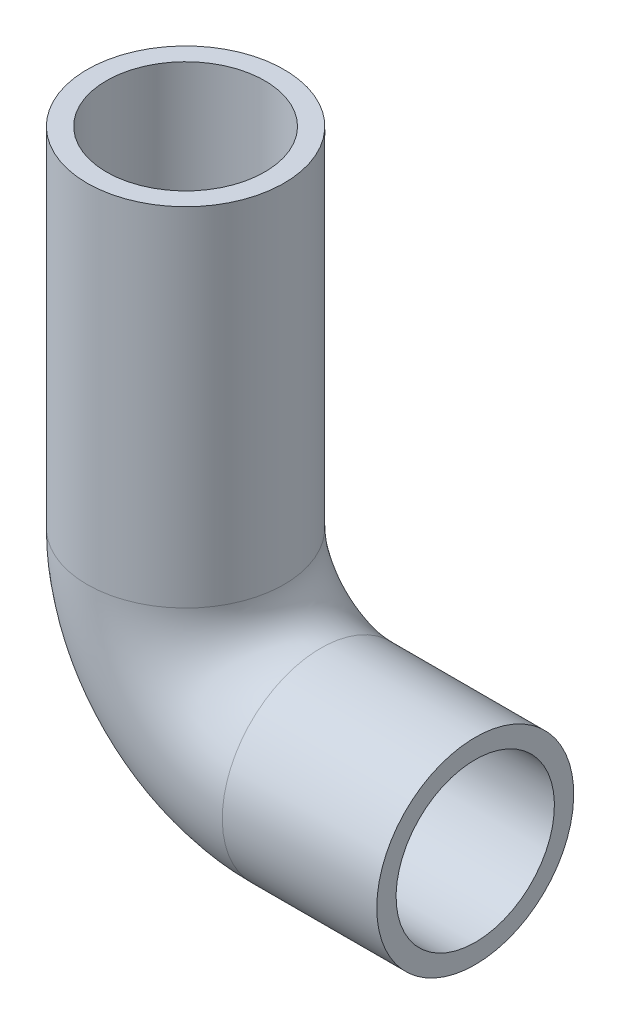
from build123d import *

# Parameters (mm, degrees)
SKETCH2_R = 51
SHELL1_T  = -10


with BuildPart() as part:
    # Sweep10: sweep along a path in Sketch1
    with BuildLine(Plane.XY) as sweep10_path:
        Line((0, 250), (0, 70))
        ThreePointArc((0, 70), (20.502525317, 20.502525317), (70, 0))
        Line((70, 0), (150, 0))
    # Sketch2 → Sweep10 (sweep)
    with BuildSketch(Plane(origin=(0, 250, 0), x_dir=(1, 0, 0), z_dir=(0, 1, 0))):
        Circle(SKETCH2_R)
    sweep(path=sweep10_path.line)

    # Shell1
    shell1_openings = [part.faces().sort_by_distance(p)[0] for p in [
        (150, 0, 0),
        (0, 250, 0),
    ]]
    offset(amount=SHELL1_T, openings=shell1_openings, kind=Kind.INTERSECTION)


solid = part.part
